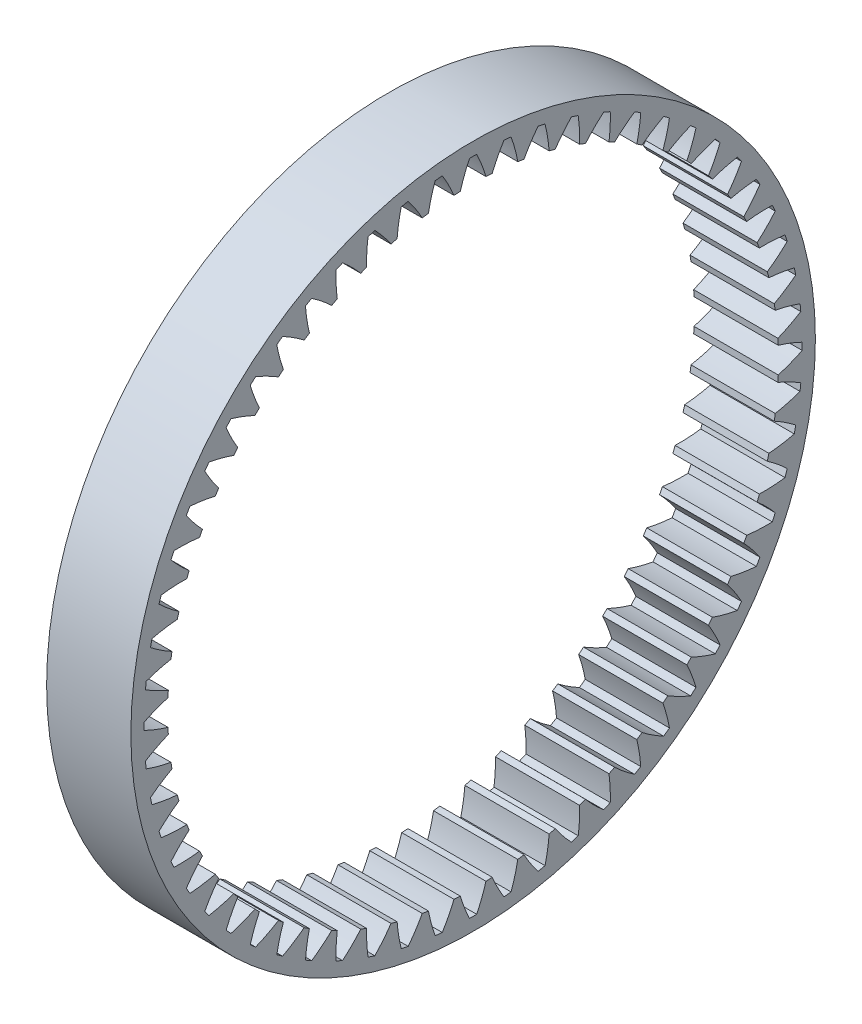
from build123d import *

# Parameters (mm, degrees)
BASPROSKE_W     = 8
BASPROSKE_H     = 3.5
TOOTHCUT_DEPTH  = 47.652974182
TEETHCUTS_COUNT = 60
TEETHCUTS_ANGLE = 354


with BuildPart() as part:
    # BasProSke → Base-Revolve (revolve)
    with BuildSketch(Plane(origin=(0, 0, 0), x_dir=(1, 0, 0), z_dir=(0, 1, 0)), mode=Mode.PRIVATE) as base_revolve_sk:
        with Locations((4, 30.75)):
            Rectangle(BASPROSKE_W, BASPROSKE_H)
    revolve(base_revolve_sk.sketch.rotate(Axis((-10, 0, 0), (1, 0, 0)), 180), axis=Axis((-10, 0, 0), (1, 0, 0)))

    # TooCutSke → ToothCut (cut, through all)
    with BuildSketch(Plane(origin=(0, 0, 0), x_dir=(0, 0, -1), z_dir=(1, 0, 0))):
        with BuildLine():
            ThreePointArc((1.227357706, 28.948593027), (0.830805794, 30.117149174), (0.339543276, 31.24915537))
            ThreePointArc((0.339543276, 31.24915537), (0, 31.251), (-0.339543276, 31.24915537))
            ThreePointArc((-0.339543276, 31.24915537), (-0.830805794, 30.117149174), (-1.227357706, 28.948593027))
            ThreePointArc((-1.227357706, 28.948593027), (0, 28.9746), (1.227357706, 28.948593027))
        make_face()
    toothcut = extrude(amount=TOOTHCUT_DEPTH, mode=Mode.SUBTRACT)

    # TeethCuts: ToothCut ×60 about axis
    teethcuts_axis = Axis((-10, 0, 0), (1, 0, 0))
    for i in range(1, TEETHCUTS_COUNT):
        add(toothcut.rotate(teethcuts_axis, i * TEETHCUTS_ANGLE / (TEETHCUTS_COUNT - 1)), mode=Mode.SUBTRACT)


solid = part.part
